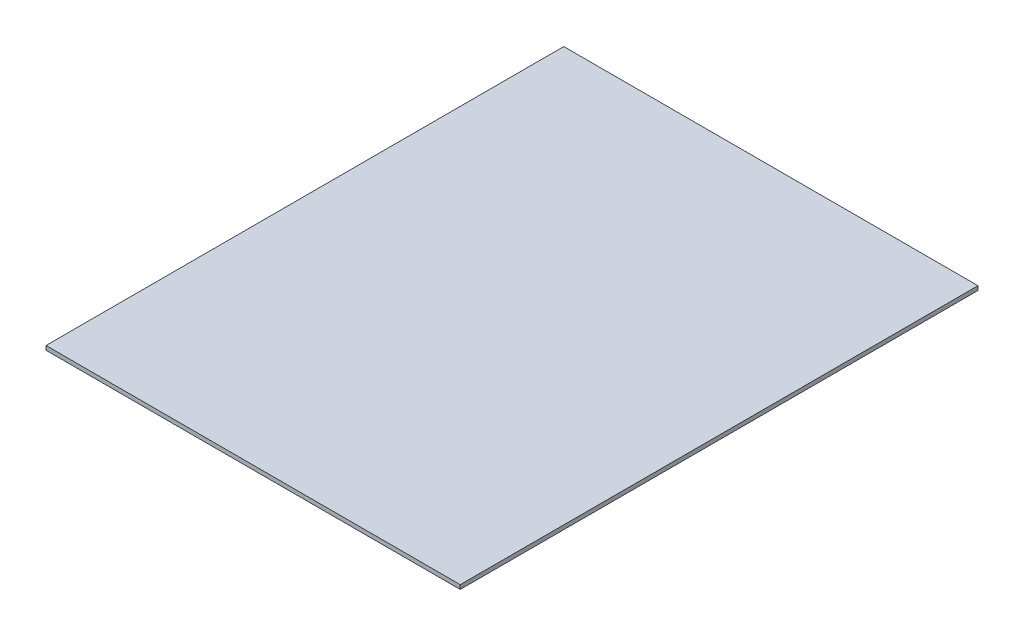
from build123d import *

# Parameters (mm, degrees)
SKETCH1_W           = 4000
SKETCH1_H           = 5000
BOSS_EXTRUDE1_DEPTH = 40


with BuildPart() as part:
    # Sketch1 → Boss-Extrude1 (new body)
    with BuildSketch(Plane(origin=(0, 0, 0), x_dir=(1, 0, 0), z_dir=(0, 1, 0))):
        Rectangle(SKETCH1_W, SKETCH1_H)
    extrude(amount=BOSS_EXTRUDE1_DEPTH)


solid = part.part
